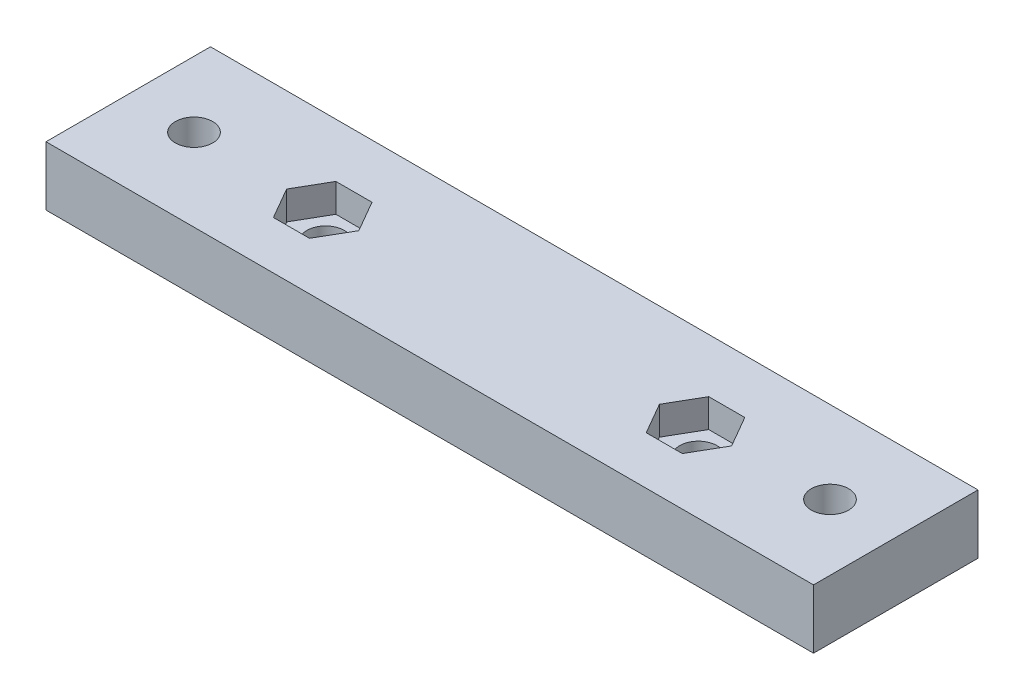
from build123d import *

# Parameters (mm, degrees)
SKETCH1_W           = 70
SKETCH1_H           = 15
BOSS_EXTRUDE1_DEPTH = 5.4
CUT_EXTRUDE1_DEPTH  = 2.6
SKETCH4_R           = 1.7
CUT_EXTRUDE3_DEPTH  = 5.4


with BuildPart() as part:
    # Sketch1 → Boss-Extrude1 (new body)
    with BuildSketch(Plane(origin=(0, 0, 0), x_dir=(1, 0, 0), z_dir=(0, 1, 0))):
        Rectangle(SKETCH1_W, SKETCH1_H)
    extrude(amount=BOSS_EXTRUDE1_DEPTH)

    # Sketch2 → Cut-Extrude1 (cut)
    with BuildSketch(Plane(origin=(0, 5.4, 0), x_dir=(1, 0, 0), z_dir=(0, 1, 0))):
        Polygon((-15.354551733, 2.58658374), (-18.645448267, 2.58658374), (-20.290896534, -0.26341626), (-18.645448267, -3.11341626), (-15.354551733, -3.11341626), (-13.709103466, -0.26341626), align=None)
        Polygon((13.709103466, -0.26341626), (15.354551733, 2.58658374), (18.645448267, 2.58658374), (20.290896534, -0.26341626), (18.645448267, -3.11341626), (15.354551733, -3.11341626), align=None)
    extrude(amount=-CUT_EXTRUDE1_DEPTH, mode=Mode.SUBTRACT)

    # Sketch4 → Cut-Extrude3 (cut)
    with BuildSketch(Plane(origin=(0, 5.4, 0), x_dir=(1, 0, 0), z_dir=(0, 1, 0))):
        with Locations(Location((-29, 0, 0), (0, 0, 270))):
            Circle(SKETCH4_R)
        with Locations(Location((-17, 0, 0), (0, 0, 270))):
            Circle(SKETCH4_R)
        with Locations(Location((17, 0, 0), (0, 0, 270))):
            Circle(SKETCH4_R)
        with Locations(Location((29, 0, 0), (0, 0, 270))):
            Circle(SKETCH4_R)
    extrude(amount=-CUT_EXTRUDE3_DEPTH, mode=Mode.SUBTRACT)


solid = part.part
